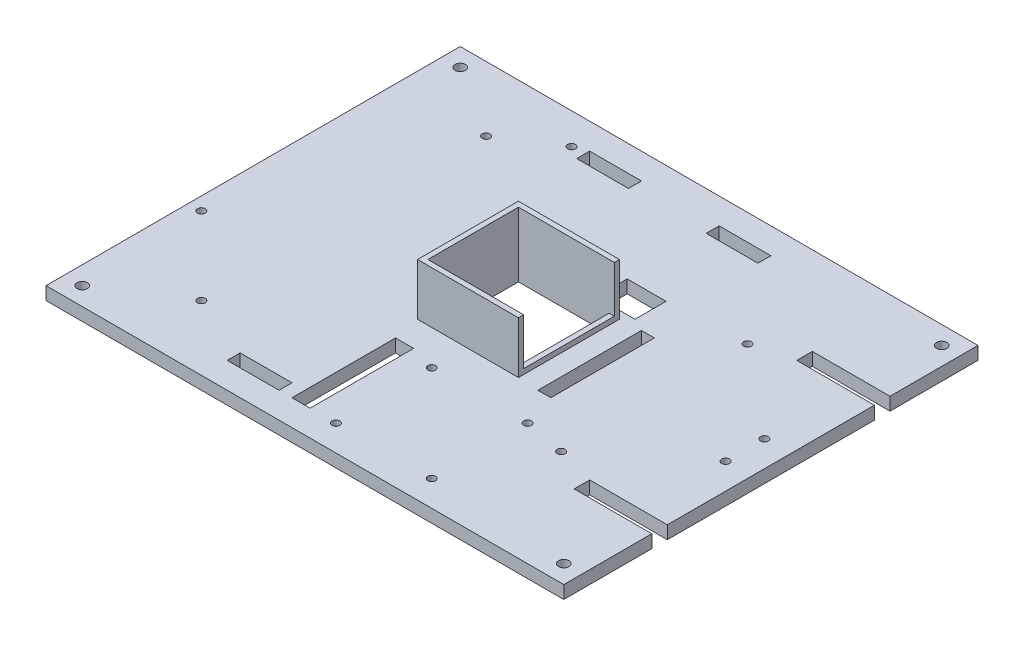
from build123d import *

# Parameters (mm, degrees)
SKETCH1_W           = 200
SKETCH1_H           = 160
BOSS_EXTRUDE1_DEPTH = 5
SKETCH2_R           = 2
CUT_EXTRUDE1_DEPTH  = 5
SKETCH3_R           = 1.5
CUT_EXTRUDE4_DEPTH  = 5
SKETCH4_R           = 1.5
CUT_EXTRUDE5_DEPTH  = 5
SKETCH5_W           = 35
SKETCH5_H           = 35
CUT_EXTRUDE6_DEPTH  = 5
SKETCH7_W           = 7
SKETCH7_H           = 40
SKETCH7_W_2         = 5
SKETCH7_W_3         = 20
SKETCH7_H_2         = 5
CUT_EXTRUDE7_DEPTH  = 5
SKETCH8_W           = 15
SKETCH8_H           = 12
SKETCH8_W_2         = 30
SKETCH8_H_2         = 6
CUT_EXTRUDE8_DEPTH  = 5
SKETCH9_W           = 20
SKETCH9_H           = 5
CUT_EXTRUDE9_DEPTH  = 5
SKETCH10_R          = 1.5
CUT_EXTRUDE10_DEPTH = 5
SKETCH11_R          = 1.5
CUT_EXTRUDE11_DEPTH = 5
SKETCH12_R          = 1.5
CUT_EXTRUDE12_DEPTH = 5
SKETCH14_W          = 2
SKETCH14_H          = 35
BOSS_EXTRUDE3_DEPTH = 20
SKETCH15_W          = 39
SKETCH15_H          = 2
BOSS_EXTRUDE4_DEPTH = 20
SKETCH16_W          = 39
SKETCH16_H          = 2
BOSS_EXTRUDE5_DEPTH = 20
SKETCH17_W          = 35
SKETCH17_H          = 18
CUT_EXTRUDE13_DEPTH = 20


with BuildPart() as part:
    # Sketch1 → Boss-Extrude1 (new body)
    with BuildSketch(Plane(origin=(0, 0, 0), x_dir=(1, 0, 0), z_dir=(0, 1, 0))):
        Rectangle(SKETCH1_W, SKETCH1_H)
    extrude(amount=BOSS_EXTRUDE1_DEPTH)

    # Sketch2 → Cut-Extrude1 (cut)
    with BuildSketch(Plane(origin=(0, 5, 0), x_dir=(1, 0, 0), z_dir=(0, 1, 0))):
        with Locations(Location((-93, 73, 0), (0, 0, 270))):
            Circle(SKETCH2_R)
        with Locations(Location((93, 73, 0), (0, 0, 90))):
            Circle(SKETCH2_R)
        with Locations(Location((93, -73, 0), (0, 0, 270))):
            Circle(SKETCH2_R)
        with Locations(Location((-93, -73, 0), (0, 0, 90))):
            Circle(SKETCH2_R)
    extrude(amount=-CUT_EXTRUDE1_DEPTH, mode=Mode.SUBTRACT)

    # Sketch3 → Cut-Extrude4 (cut)
    with BuildSketch(Plane(origin=(0, 5, 0), x_dir=(1, 0, 0), z_dir=(0, 1, 0))):
        with Locations(Location((90, 7.5, 0), (0, 0, 270))):
            Circle(SKETCH3_R)
        with Locations(Location((90, -7.5, 0), (0, 0, 90))):
            Circle(SKETCH3_R)
    extrude(amount=-CUT_EXTRUDE4_DEPTH, mode=Mode.SUBTRACT)

    # Sketch4 → Cut-Extrude5 (cut)
    with BuildSketch(Plane(origin=(0, 5, 0), x_dir=(1, 0, 0), z_dir=(0, 1, 0))):
        with Locations(Location((55, 36, 0), (0, 0, 270))):
            Circle(SKETCH4_R)
        with Locations(Location((55, -36, 0), (0, 0, 90))):
            Circle(SKETCH4_R)
    extrude(amount=-CUT_EXTRUDE5_DEPTH, mode=Mode.SUBTRACT)

    # Sketch5 → Cut-Extrude6 (cut)
    with BuildSketch(Plane(origin=(0, 5, 0), x_dir=(1, 0, 0), z_dir=(0, 1, 0))):
        with Locations((2.5, 0)):
            Rectangle(SKETCH5_W, SKETCH5_H)
    extrude(amount=-CUT_EXTRUDE6_DEPTH, mode=Mode.SUBTRACT)

    # Sketch7 → Cut-Extrude7 (cut)
    with BuildSketch(Plane(origin=(0, 5, 0), x_dir=(1, 0, 0), z_dir=(0, 1, 0))):
        with Locations((-11.5, -50)):
            Rectangle(SKETCH7_W, SKETCH7_H)
        with Locations((32.5, 0)):
            Rectangle(SKETCH7_W_2, SKETCH7_H)
        with Locations((-30, 67.5)):
            Rectangle(SKETCH7_W_3, SKETCH7_H_2)
        with Locations((-30, -67.5)):
            Rectangle(SKETCH7_W_3, SKETCH7_H_2)
    extrude(amount=-CUT_EXTRUDE7_DEPTH, mode=Mode.SUBTRACT)

    # Sketch8 → Cut-Extrude8 (cut)
    with BuildSketch(Plane(origin=(0, 5, 0), x_dir=(1, 0, 0), z_dir=(0, 1, 0))):
        with Locations((17.5, 28.5)):
            Rectangle(SKETCH8_W, SKETCH8_H)
        with Locations((85, 43)):
            Rectangle(SKETCH8_W_2, SKETCH8_H_2)
        with Locations((85, -43)):
            Rectangle(SKETCH8_W_2, SKETCH8_H_2)
    extrude(amount=-CUT_EXTRUDE8_DEPTH, mode=Mode.SUBTRACT)

    # Sketch9 → Cut-Extrude9 (cut)
    with BuildSketch(Plane(origin=(0, 5, 0), x_dir=(1, 0, 0), z_dir=(0, 1, 0))):
        with Locations((20, 67.5)):
            Rectangle(SKETCH9_W, SKETCH9_H)
    extrude(amount=-CUT_EXTRUDE9_DEPTH, mode=Mode.SUBTRACT)

    # Sketch10 → Cut-Extrude10 (cut)
    with BuildSketch(Plane(origin=(0, 5, 0), x_dir=(1, 0, 0), z_dir=(0, 1, 0))):
        with Locations(Location((-95, -25, 0), (0, 0, 270))):
            Circle(SKETCH10_R)
        with Locations(Location((-45, 68, 0), (0, 0, 270))):
            Circle(SKETCH10_R)
    extrude(amount=-CUT_EXTRUDE10_DEPTH, mode=Mode.SUBTRACT)

    # Sketch11 → Cut-Extrude11 (cut)
    with BuildSketch(Plane(origin=(0, 5, 0), x_dir=(1, 0, 0), z_dir=(0, 1, 0))):
        with Locations(Location((2, -33, 0), (0, 0, 270))):
            Circle(SKETCH11_R)
        with Locations(Location((2, -70, 0), (0, 0, 90))):
            Circle(SKETCH11_R)
        with Locations(Location((39, -70, 0), (0, 0, 270))):
            Circle(SKETCH11_R)
        with Locations(Location((39, -33, 0), (0, 0, 90))):
            Circle(SKETCH11_R)
    extrude(amount=-CUT_EXTRUDE11_DEPTH, mode=Mode.SUBTRACT)

    # Sketch12 → Cut-Extrude12 (cut)
    with BuildSketch(Plane(origin=(0, 5, 0), x_dir=(1, 0, 0), z_dir=(0, 1, 0))):
        with Locations(Location((-65, 55, 0), (0, 0, 270))):
            Circle(SKETCH12_R)
        with Locations(Location((-65, -55, 0), (0, 0, 90))):
            Circle(SKETCH12_R)
    extrude(amount=-CUT_EXTRUDE12_DEPTH, mode=Mode.SUBTRACT)

    # Sketch14 → Boss-Extrude3 (add)
    with BuildSketch(Plane(origin=(0, 5, 0), x_dir=(1, 0, 0), z_dir=(0, 1, 0))):
        with Locations((-16, 0)):
            Rectangle(SKETCH14_W, SKETCH14_H)
        with Locations((21, 0)):
            Rectangle(SKETCH14_W, SKETCH14_H)
    extrude(amount=BOSS_EXTRUDE3_DEPTH)

    # Sketch15 → Boss-Extrude4 (add)
    with BuildSketch(Plane(origin=(0, 5, 0), x_dir=(1, 0, 0), z_dir=(0, 1, 0))):
        with Locations((2.5, -18.5)):
            Rectangle(SKETCH15_W, SKETCH15_H)
    extrude(amount=BOSS_EXTRUDE4_DEPTH)

    # Sketch16 → Boss-Extrude5 (add)
    with BuildSketch(Plane(origin=(0, 5, 0), x_dir=(1, 0, 0), z_dir=(0, 1, 0))):
        with Locations((2.5, 18.5)):
            Rectangle(SKETCH16_W, SKETCH16_H)
    extrude(amount=BOSS_EXTRUDE5_DEPTH)

    # Sketch17 → Cut-Extrude13 (cut)
    with BuildSketch(Plane(origin=(22, 0, 0), x_dir=(0, 0, -1), z_dir=(1, 0, 0))):
        with Locations((0, 16)):
            Rectangle(SKETCH17_W, SKETCH17_H)
    extrude(amount=-CUT_EXTRUDE13_DEPTH, mode=Mode.SUBTRACT)


solid = part.part
